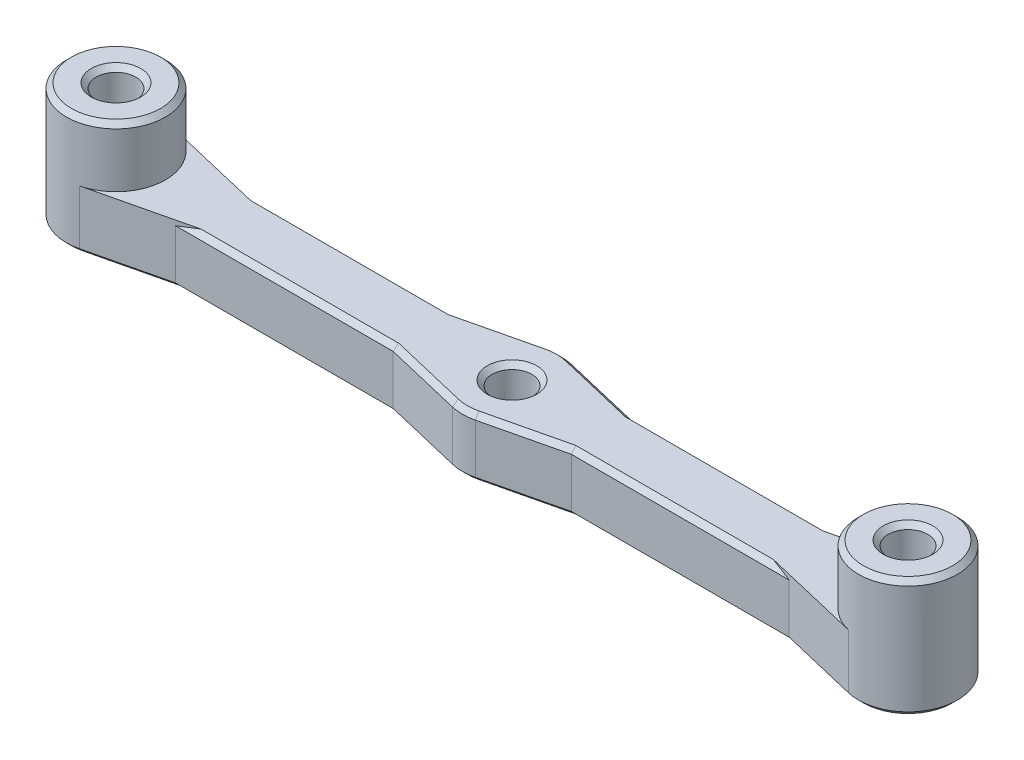
from build123d import *
from build123d.topology import SkipClean

# Parameters (mm, degrees)
SKETCH_1_R      = 1
EXTRUDE_1_DEPTH = 3
EXTRUDE_2_DEPTH = 3
CHAMFER_1_SIZE  = 0.25
EXTRUDE_START   = 3
SKETCH_4_R      = 2.5
SKETCH_4_R_2    = 1
EXTRUDE_3_DEPTH = 3
CHAMFER_4_SIZE  = 0.25
CHAMFER_5_SIZE  = 0.25


with BuildPart() as part:
    # 草图1 → 凸台-拉伸1 (new body)
    with BuildSketch(Plane(origin=(0, 0, 0), x_dir=(1, 0, 0), z_dir=(0, 1, 0))):
        with BuildLine():
            Line((-18, 1.5), (-2, 1.5))
            ThreePointArc((-2, 1.5), (0, 2.5), (2, 1.5))
            Line((2, 1.5), (18, 1.5))
            ThreePointArc((18, 1.5), (22.5, 0), (18, -1.5))
            Line((18, -1.5), (2, -1.5))
            ThreePointArc((2, -1.5), (0, -2.5), (-2, -1.5))
            Line((-2, -1.5), (-18, -1.5))
            ThreePointArc((-18, -1.5), (-22.5, 0), (-18, 1.5))
        make_face()
        with Locations(Location((-20, 0, 0), (0, 0, 270))):
            Circle(SKETCH_1_R, mode=Mode.SUBTRACT)
        with Locations(Location((0, 0, 0), (0, 0, 270))):
            Circle(SKETCH_1_R, mode=Mode.SUBTRACT)
        with Locations(Location((20, 0, 0), (0, 0, 270))):
            Circle(SKETCH_1_R, mode=Mode.SUBTRACT)
    extrude(amount=EXTRUDE_1_DEPTH)

    # 草图2 → 凸台-拉伸2 (add)
    with BuildSketch(Plane(origin=(0, 0, 0), x_dir=(1, 0, 0), z_dir=(0, 1, 0))):
        with BuildLine():
            Line((4.5, 1.5), (0.578145, 2.432231))
            ThreePointArc((0.578145, 2.432231), (1.370756, 2.0907), (2, 1.5))
            Line((2, 1.5), (4.5, 1.5))
        make_face()
        with BuildLine():
            Line((4.5, -1.5), (0.578145, -2.432231))
            ThreePointArc((0.578145, -2.432231), (1.370756, -2.0907), (2, -1.5))
            Line((2, -1.5), (4.5, -1.5))
        make_face()
        with BuildLine():
            Line((15.5, 1.5), (19.421855, 2.432231))
            ThreePointArc((19.421855, 2.432231), (18.629244, 2.0907), (18, 1.5))
            Line((18, 1.5), (15.5, 1.5))
        make_face()
        with BuildLine():
            Line((15.5, -1.5), (19.421855, -2.432231))
            ThreePointArc((19.421855, -2.432231), (18.629244, -2.0907), (18, -1.5))
            Line((18, -1.5), (15.5, -1.5))
        make_face()
        with BuildLine():
            Line((-4.5, 1.5), (-2, 1.5))
            ThreePointArc((-2, 1.5), (-1.370756, 2.0907), (-0.578145, 2.432231))
            Line((-0.578145, 2.432231), (-4.5, 1.5))
        make_face()
        with BuildLine():
            Line((-15.5, -1.5), (-18, -1.5))
            ThreePointArc((-18, -1.5), (-18.629244, -2.0907), (-19.421855, -2.432231))
            Line((-19.421855, -2.432231), (-15.5, -1.5))
        make_face()
        with BuildLine():
            Line((-18, 1.5), (-15.5, 1.5))
            Line((-15.5, 1.5), (-19.421855, 2.432231))
            ThreePointArc((-19.421855, 2.432231), (-18.629244, 2.0907), (-18, 1.5))
        make_face()
        with BuildLine():
            Line((-2, -1.5), (-4.5, -1.5))
            Line((-4.5, -1.5), (-0.578145, -2.432231))
            ThreePointArc((-0.578145, -2.432231), (-1.370756, -2.0907), (-2, -1.5))
        make_face()
    extrude(amount=EXTRUDE_2_DEPTH)

    # 倒角1
    chamfer_1_edges = [part.edges().sort_by_distance(p)[0] for p in [
        (-10, 0, -1.5),
        (-2.539073, 0, -1.966116),
        (-20, 0, -1),
        (0, 0, -1),
        (20, 0, -1),
        (0, 0, -2.5),
        (2.539073, 0, -1.966116),
        (-22.5, 0, 0),
        (-17.460927, 0, -1.966116),
        (-10, 0, 1.5),
        (-17.460927, 0, 1.966116),
        (0, 0, 2.5),
        (-2.539073, 0, 1.966116),
        (10, 0, 1.5),
        (2.539073, 0, 1.966116),
        (22.5, 0, 0),
        (17.460927, 0, 1.966116),
        (10, 0, -1.5),
        (17.460927, 0, -1.966116),
    ]]
    chamfer(chamfer_1_edges, length=CHAMFER_1_SIZE)

    # 草图4 → 凸台-拉伸3 (add)
    # profile 1 of 2: a face of its own
    with SkipClean():  # the faces are left unmerged after this step: merging them gives an invalid solid
        with BuildSketch(Plane(origin=(0, 0, 0), x_dir=(1, 0, 0), z_dir=(0, 1, 0)).offset(EXTRUDE_START)):
            with Locations(Location((-20, 0, 0), (0, 0, 76.628849))):
                Circle(SKETCH_4_R)
            with Locations(Location((-20, 0, 0), (0, 0, 270))):
                Circle(SKETCH_4_R_2, mode=Mode.SUBTRACT)
        # profile 2 of 2: a face of its own
        with BuildSketch(Plane(origin=(0, 0, 0), x_dir=(1, 0, 0), z_dir=(0, 1, 0)).offset(EXTRUDE_START)):
            with Locations(Location((20, 0, 0), (0, 0, 103.371151))):
                Circle(SKETCH_4_R)
            with Locations(Location((20, 0, 0), (0, 0, 270))):
                Circle(SKETCH_4_R_2, mode=Mode.SUBTRACT)
        extrude(amount=EXTRUDE_3_DEPTH)

    # 倒角4
    chamfer_4_edges = [part.edges().sort_by_distance(p)[0] for p in [
        (-20.578145, 6, 2.432231),
        (-20, 6, -1),
        (20.578145, 6, 2.432231),
        (20, 6, -1),
    ]]
    chamfer(chamfer_4_edges, length=CHAMFER_4_SIZE)

    # 倒角5
    chamfer_5_edges = [part.edges().sort_by_distance(p)[0] for p in [
        (-10, 3, -1.5),
        (-2.539073, 3, -1.966116),
        (0, 3, -1),
        (0, 3, -2.5),
        (2.539073, 3, -1.966116),
        (-10, 3, 1.5),
        (0, 3, 2.5),
        (-2.539073, 3, 1.966116),
        (10, 3, 1.5),
        (2.539073, 3, 1.966116),
        (10, 3, -1.5),
    ]]
    chamfer(chamfer_5_edges, length=CHAMFER_5_SIZE)


solid = part.part
